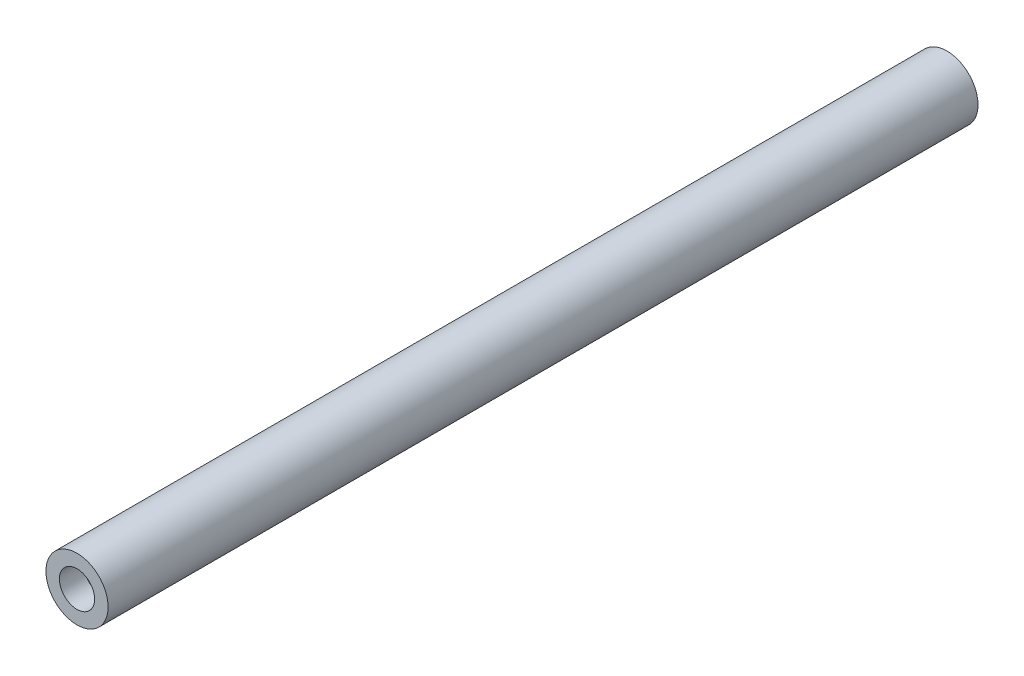
from build123d import *

# Parameters (mm, degrees)
ESQUISSE1_R             = 6.35
BOSS_EXTRU_1_DEPTH      = 177.8
ESQUISSE2_R             = 3.6
ENL_V_MAT_EXTRU_1_DEPTH = 5


with BuildPart() as part:
    # Esquisse1 → Boss.-Extru.1 (new body)
    with BuildSketch(Plane.XY):
        Circle(ESQUISSE1_R)
    extrude(amount=-BOSS_EXTRU_1_DEPTH)

    # Esquisse2 → Enlèv. mat.-Extru.1 (cut)
    with BuildSketch(Plane.XY):
        Circle(ESQUISSE2_R)
    extrude(amount=-ENL_V_MAT_EXTRU_1_DEPTH, mode=Mode.SUBTRACT)


solid = part.part
